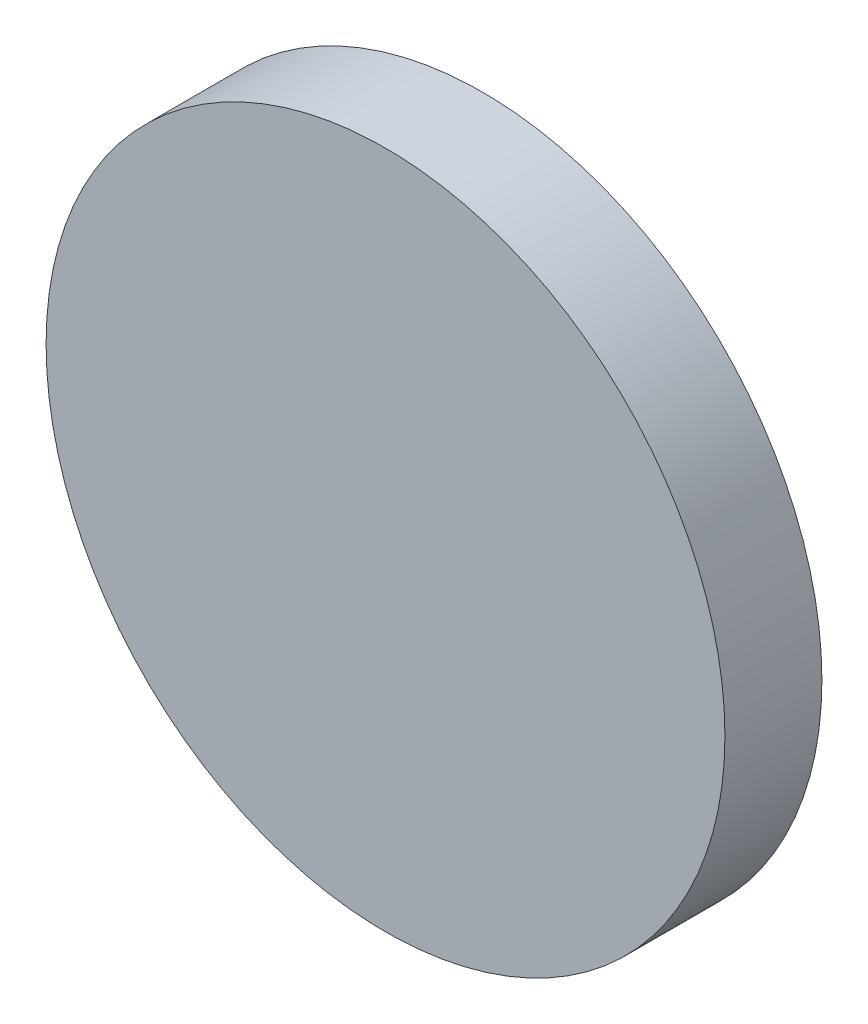
from build123d import *

# Parameters (mm, degrees)
SZKIC1_R                    = 14
DODANIE_WYCI_GNI_CIE1_DEPTH = 4


with BuildPart() as part:
    # Szkic1 → Dodanie-wyciągnięcie1 (new body)
    with BuildSketch(Plane.XY):
        Circle(SZKIC1_R)
    extrude(amount=DODANIE_WYCI_GNI_CIE1_DEPTH)


solid = part.part
